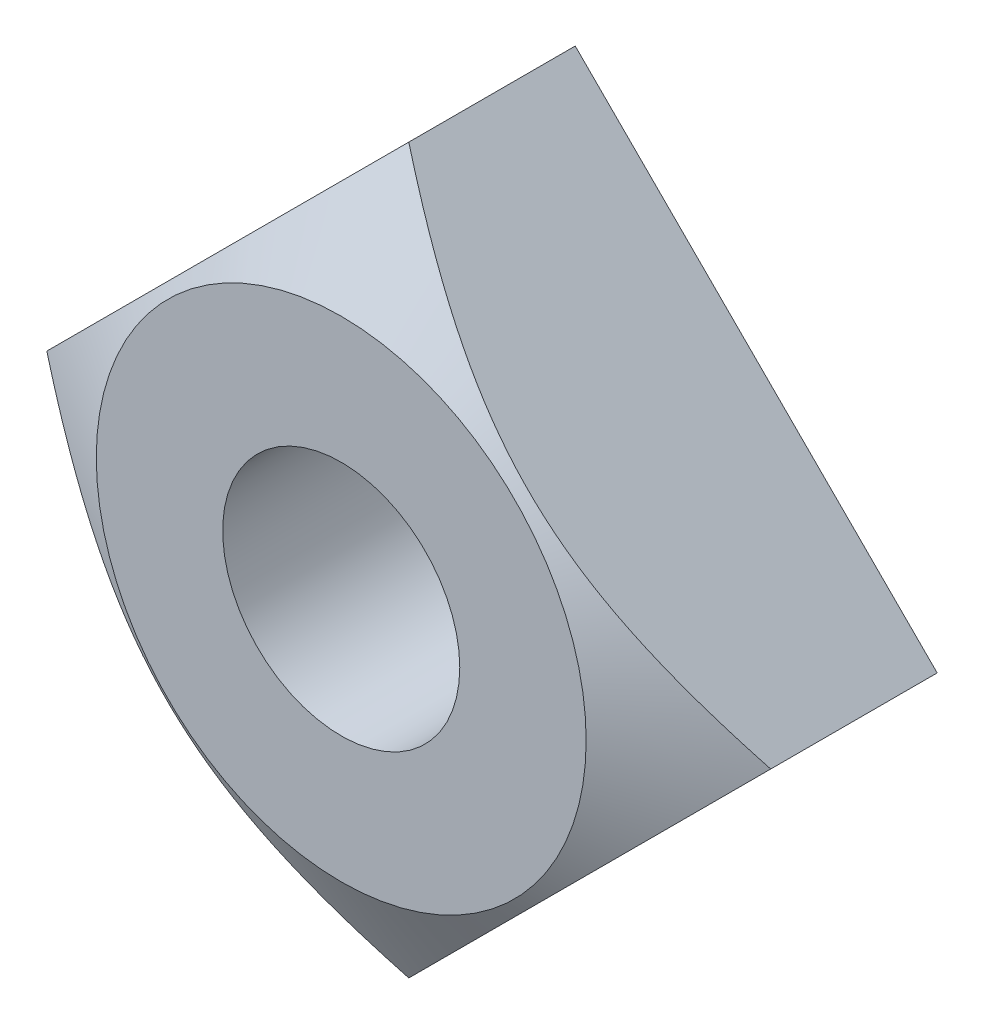
from build123d import *

# Parameters (mm, degrees)
SKETCH_7_R      = 1.621125
EXTRUDE_1_DEPTH = 3.2


with BuildPart() as part:
    # 草图7 → 凸台-拉伸1 (new body)
    with BuildSketch(Plane.XY):
        Polygon((-4.949747468, 0), (0, 4.949747468), (4.949747468, 0), (0, -4.949747468), align=None)
        Circle(SKETCH_7_R, mode=Mode.SUBTRACT)
    extrude(amount=-EXTRUDE_1_DEPTH)

    # 草图8 → 切除-旋转1 (revolve, cut)
    with BuildSketch(Plane(origin=(0, 0, 0), x_dir=(0, 0, -1), z_dir=(1, 0, 0))):
        Polygon((0.923760431, 4.949747468), (0, 3.349747468), (0, 4.949747468), align=None)
    revolve(axis=Axis((0, 0, 0), (0, 0, -1)), mode=Mode.SUBTRACT)


solid = part.part
